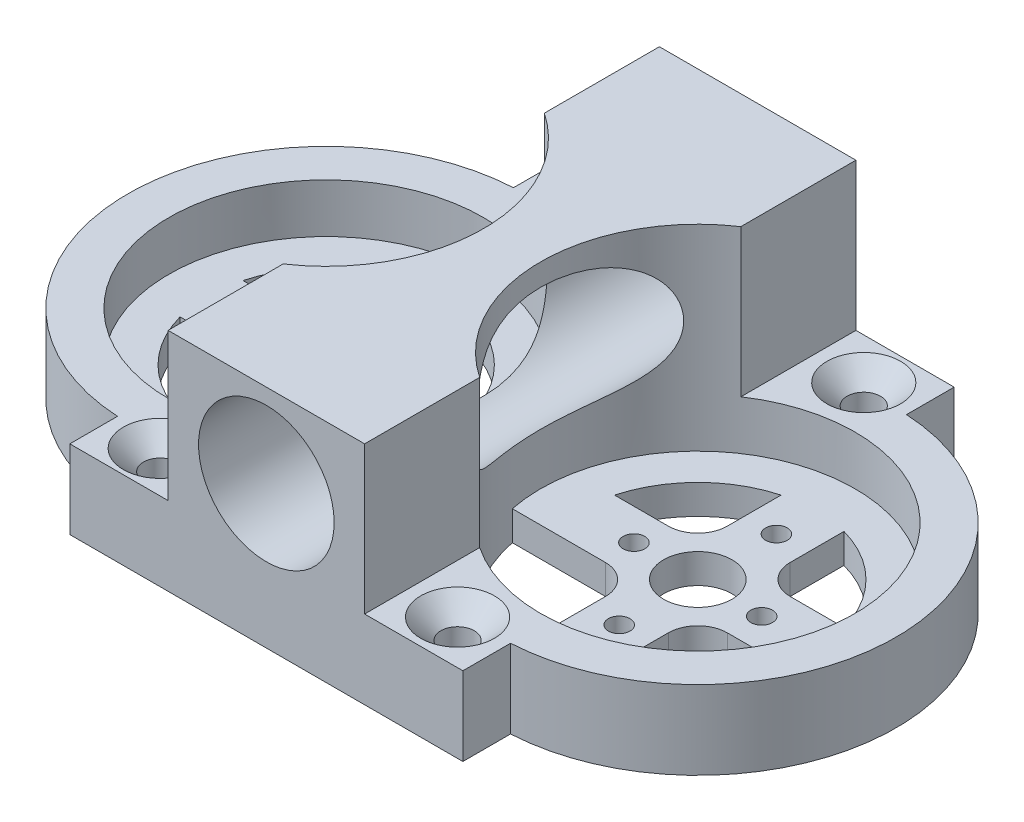
from build123d import *

# Parameters (mm, degrees)
BOSS_EXTRUDE1_DEPTH                                 = 8
SKETCH4_R                                           = 16
CUT_EXTRUDE1_DEPTH                                  = 5
CUT_EXTRUDE3_REACH                                  = 55.957
SKETCH6_R                                           = 1.1
SKETCH6_R_2                                         = 3.2
SKETCH6_R_3                                         = 3.481223099
BOSS_EXTRUDE2_START                                 = 15
BOSS_EXTRUDE2_DEPTH                                 = 15
CUT_EXTRUDE4_REACH                                  = 73.743
SKETCH7_R                                           = 6.9
CSK_FOR_M3_COUNTERSUNK_FLAT_HEAD_SCREW1_D           = 3.4
CSK_FOR_M3_COUNTERSUNK_FLAT_HEAD_SCREW1_DEPTH       = 10
CSK_FOR_M3_COUNTERSUNK_FLAT_HEAD_SCREW1_CSINK_D     = 7.5
CSK_FOR_M3_COUNTERSUNK_FLAT_HEAD_SCREW1_CSINK_ANGLE = 90
CSK_FOR_M3_COUNTERSUNK_FLAT_HEAD_SCREW1_TIP         = 1.021463052


with BuildPart() as part:
    # Sketch2 → Boss-Extrude1 (new body)
    with BuildSketch(Plane(origin=(0, 0, 0), x_dir=(1, 0, 0), z_dir=(0, 1, 0))):
        with BuildLine():
            Line((-26.93482114, -17.430691923), (-26.93482114, -22.282367874))
            Line((-26.93482114, -22.282367874), (13.06517886, -22.282367874))
            Line((13.06517886, -22.282367874), (13.06517886, -17.430691923))
            ThreePointArc((13.06517886, -17.430691923), (32.15296521, 2.717632126), (13.06517886, 22.865956175))
            Line((13.06517886, 22.865956175), (13.06517886, 27.717632126))
            Line((13.06517886, 27.717632126), (-26.93482114, 27.717632126))
            Line((-26.93482114, 27.717632126), (-26.93482114, 22.865956175))
            ThreePointArc((-26.93482114, 22.865956175), (-46.02260749, 2.717632126), (-26.93482114, -17.430691923))
        make_face()
    extrude(amount=BOSS_EXTRUDE1_DEPTH)

    # Sketch4 → Cut-Extrude1 (cut)
    with BuildSketch(Plane(origin=(0, 8, 0), x_dir=(1, 0, 0), z_dir=(0, 1, 0))):
        with Locations(Location((-25.84482114, 2.717632126, 0), (0, 0, 270))):
            Circle(SKETCH4_R)
        with Locations(Location((11.97517886, 2.717632126, 0), (0, 0, 270))):
            Circle(SKETCH4_R)
    extrude(amount=-CUT_EXTRUDE1_DEPTH, mode=Mode.SUBTRACT)

    # Sketch6 → Cut-Extrude3 (cut, up to next)
    with BuildSketch(Plane(origin=(0, 3, 0), x_dir=(1, 0, 0), z_dir=(0, 1, 0)), mode=Mode.PRIVATE) as cut_extrude3_sk1:
        with Locations(Location((-33.84482114, 2.717632126, 0), (0, 0, 270))):
            Circle(SKETCH6_R)
    cut_extrude3_tool1 = extrude(cut_extrude3_sk1.sketch, amount=-CUT_EXTRUDE3_REACH, mode=Mode.PRIVATE) & part.part
    # Sketch6 → Cut-Extrude3 (cut, up to next)
    with BuildSketch(Plane(origin=(0, 3, 0), x_dir=(1, 0, 0), z_dir=(0, 1, 0)), mode=Mode.PRIVATE) as cut_extrude3_sk2:
        with Locations(Location((-17.84482114, 2.717632126, 0), (0, 0, 270))):
            Circle(SKETCH6_R)
    cut_extrude3_tool2 = extrude(cut_extrude3_sk2.sketch, amount=-CUT_EXTRUDE3_REACH, mode=Mode.PRIVATE) & part.part
    # Sketch6 → Cut-Extrude3 (cut, up to next)
    with BuildSketch(Plane(origin=(0, 3, 0), x_dir=(1, 0, 0), z_dir=(0, 1, 0)), mode=Mode.PRIVATE) as cut_extrude3_sk3:
        with Locations(Location((-25.84482114, 8.717632126, 0), (0, 0, 270))):
            Circle(SKETCH6_R)
    cut_extrude3_tool3 = extrude(cut_extrude3_sk3.sketch, amount=-CUT_EXTRUDE3_REACH, mode=Mode.PRIVATE) & part.part
    # Sketch6 → Cut-Extrude3 (cut, up to next)
    with BuildSketch(Plane(origin=(0, 3, 0), x_dir=(1, 0, 0), z_dir=(0, 1, 0)), mode=Mode.PRIVATE) as cut_extrude3_sk4:
        with Locations(Location((-25.84482114, -3.282367874, 0), (0, 0, 270))):
            Circle(SKETCH6_R)
    cut_extrude3_tool4 = extrude(cut_extrude3_sk4.sketch, amount=-CUT_EXTRUDE3_REACH, mode=Mode.PRIVATE) & part.part
    # Sketch6 → Cut-Extrude3 (cut, up to next)
    with BuildSketch(Plane(origin=(0, 3, 0), x_dir=(1, 0, 0), z_dir=(0, 1, 0)), mode=Mode.PRIVATE) as cut_extrude3_sk5:
        with Locations(Location((-25.84482114, 2.717632126, 0), (0, 0, 270))):
            Circle(SKETCH6_R_2)
    cut_extrude3_tool5 = extrude(cut_extrude3_sk5.sketch, amount=-CUT_EXTRUDE3_REACH, mode=Mode.PRIVATE) & part.part
    # Sketch6 → Cut-Extrude3 (cut, up to next)
    with BuildSketch(Plane(origin=(0, 3, 0), x_dir=(1, 0, 0), z_dir=(0, 1, 0)), mode=Mode.PRIVATE) as cut_extrude3_sk6:
        with Locations(Location((18.47517886, 2.717632126, 0), (0, 0, 270))):
            Circle(SKETCH6_R)
    cut_extrude3_tool6 = extrude(cut_extrude3_sk6.sketch, amount=-CUT_EXTRUDE3_REACH, mode=Mode.PRIVATE) & part.part
    # Sketch6 → Cut-Extrude3 (cut, up to next)
    with BuildSketch(Plane(origin=(0, 3, 0), x_dir=(1, 0, 0), z_dir=(0, 1, 0)), mode=Mode.PRIVATE) as cut_extrude3_sk7:
        with Locations(Location((11.97517886, 10.717632126, 0), (0, 0, 270))):
            Circle(SKETCH6_R)
    cut_extrude3_tool7 = extrude(cut_extrude3_sk7.sketch, amount=-CUT_EXTRUDE3_REACH, mode=Mode.PRIVATE) & part.part
    # Sketch6 → Cut-Extrude3 (cut, up to next)
    with BuildSketch(Plane(origin=(0, 3, 0), x_dir=(1, 0, 0), z_dir=(0, 1, 0)), mode=Mode.PRIVATE) as cut_extrude3_sk8:
        with Locations(Location((5.47517886, 2.717632126, 0), (0, 0, 270))):
            Circle(SKETCH6_R)
    cut_extrude3_tool8 = extrude(cut_extrude3_sk8.sketch, amount=-CUT_EXTRUDE3_REACH, mode=Mode.PRIVATE) & part.part
    # Sketch6 → Cut-Extrude3 (cut, up to next)
    with BuildSketch(Plane(origin=(0, 3, 0), x_dir=(1, 0, 0), z_dir=(0, 1, 0)), mode=Mode.PRIVATE) as cut_extrude3_sk9:
        with Locations(Location((11.97517886, -5.282367874, 0), (0, 0, 270))):
            Circle(SKETCH6_R)
    cut_extrude3_tool9 = extrude(cut_extrude3_sk9.sketch, amount=-CUT_EXTRUDE3_REACH, mode=Mode.PRIVATE) & part.part
    # Sketch6 → Cut-Extrude3 (cut, up to next)
    with BuildSketch(Plane(origin=(0, 3, 0), x_dir=(1, 0, 0), z_dir=(0, 1, 0)), mode=Mode.PRIVATE) as cut_extrude3_sk10:
        with Locations(Location((11.97517886, 2.717632126, 0), (0, 0, 270))):
            Circle(SKETCH6_R_3)
    cut_extrude3_tool10 = extrude(cut_extrude3_sk10.sketch, amount=-CUT_EXTRUDE3_REACH, mode=Mode.PRIVATE) & part.part
    # Sketch6 → Cut-Extrude3 (cut, up to next)
    with BuildSketch(Plane(origin=(0, 3, 0), x_dir=(1, 0, 0), z_dir=(0, 1, 0)), mode=Mode.PRIVATE) as cut_extrude3_sk11:
        with BuildLine():
            Line((-29.04482114, -3.482367874), (-29.04482114, -8.95674259))
            ThreePointArc((-29.04482114, -8.95674259), (-34.404348726, -5.84189546), (-37.519195856, -0.482367874))
            Line((-37.519195856, -0.482367874), (-32.04482114, -0.482367874))
            ThreePointArc((-32.04482114, -0.482367874), (-29.923500797, -1.36104753), (-29.04482114, -3.482367874))
        make_face()
    cut_extrude3_tool11 = extrude(cut_extrude3_sk11.sketch, amount=-CUT_EXTRUDE3_REACH, mode=Mode.PRIVATE) & part.part
    # Sketch6 → Cut-Extrude3 (cut, up to next)
    with BuildSketch(Plane(origin=(0, 3, 0), x_dir=(1, 0, 0), z_dir=(0, 1, 0)), mode=Mode.PRIVATE) as cut_extrude3_sk12:
        with BuildLine():
            Line((-29.04482114, 8.917632126), (-29.04482114, 14.392006842))
            ThreePointArc((-29.04482114, 14.392006842), (-34.404348726, 11.277159712), (-37.519195856, 5.917632126))
            Line((-37.519195856, 5.917632126), (-32.04482114, 5.917632126))
            ThreePointArc((-32.04482114, 5.917632126), (-29.923500797, 6.796311782), (-29.04482114, 8.917632126))
        make_face()
    cut_extrude3_tool12 = extrude(cut_extrude3_sk12.sketch, amount=-CUT_EXTRUDE3_REACH, mode=Mode.PRIVATE) & part.part
    # Sketch6 → Cut-Extrude3 (cut, up to next)
    with BuildSketch(Plane(origin=(0, 3, 0), x_dir=(1, 0, 0), z_dir=(0, 1, 0)), mode=Mode.PRIVATE) as cut_extrude3_sk13:
        with BuildLine():
            Line((-22.64482114, 8.917632126), (-22.64482114, 14.392006842))
            ThreePointArc((-22.64482114, 14.392006842), (-17.285293554, 11.277159712), (-14.170446425, 5.917632126))
            Line((-14.170446425, 5.917632126), (-19.64482114, 5.917632126))
            ThreePointArc((-19.64482114, 5.917632126), (-21.766141484, 6.796311782), (-22.64482114, 8.917632126))
        make_face()
    cut_extrude3_tool13 = extrude(cut_extrude3_sk13.sketch, amount=-CUT_EXTRUDE3_REACH, mode=Mode.PRIVATE) & part.part
    # Sketch6 → Cut-Extrude3 (cut, up to next)
    with BuildSketch(Plane(origin=(0, 3, 0), x_dir=(1, 0, 0), z_dir=(0, 1, 0)), mode=Mode.PRIVATE) as cut_extrude3_sk14:
        with BuildLine():
            Line((-22.64482114, -3.482367874), (-22.64482114, -12.959102228))
            ThreePointArc((-22.64482114, -12.959102228), (-14.531112641, -8.596076373), (-10.168086786, -0.482367874))
            Line((-10.168086786, -0.482367874), (-19.64482114, -0.482367874))
            ThreePointArc((-19.64482114, -0.482367874), (-21.766141484, -1.36104753), (-22.64482114, -3.482367874))
        make_face()
    cut_extrude3_tool14 = extrude(cut_extrude3_sk14.sketch, amount=-CUT_EXTRUDE3_REACH, mode=Mode.PRIVATE) & part.part
    # Sketch6 → Cut-Extrude3 (cut, up to next)
    with BuildSketch(Plane(origin=(0, 3, 0), x_dir=(1, 0, 0), z_dir=(0, 1, 0)), mode=Mode.PRIVATE) as cut_extrude3_sk15:
        with BuildLine():
            Line((-3.701555494, -0.482367874), (5.77517886, -0.482367874))
            ThreePointArc((5.77517886, -0.482367874), (7.896499203, -1.36104753), (8.77517886, -3.482367874))
            Line((8.77517886, -3.482367874), (8.77517886, -12.959102228))
            ThreePointArc((8.77517886, -12.959102228), (0.661470361, -8.596076373), (-3.701555494, -0.482367874))
        make_face()
    cut_extrude3_tool15 = extrude(cut_extrude3_sk15.sketch, amount=-CUT_EXTRUDE3_REACH, mode=Mode.PRIVATE) & part.part
    # Sketch6 → Cut-Extrude3 (cut, up to next)
    with BuildSketch(Plane(origin=(0, 3, 0), x_dir=(1, 0, 0), z_dir=(0, 1, 0)), mode=Mode.PRIVATE) as cut_extrude3_sk16:
        with BuildLine():
            Line((0.300804144, 5.917632126), (5.77517886, 5.917632126))
            ThreePointArc((5.77517886, 5.917632126), (7.896499203, 6.796311782), (8.77517886, 8.917632126))
            Line((8.77517886, 8.917632126), (8.77517886, 14.392006842))
            ThreePointArc((8.77517886, 14.392006842), (3.415651274, 11.277159712), (0.300804144, 5.917632126))
        make_face()
    cut_extrude3_tool16 = extrude(cut_extrude3_sk16.sketch, amount=-CUT_EXTRUDE3_REACH, mode=Mode.PRIVATE) & part.part
    # Sketch6 → Cut-Extrude3 (cut, up to next)
    with BuildSketch(Plane(origin=(0, 3, 0), x_dir=(1, 0, 0), z_dir=(0, 1, 0)), mode=Mode.PRIVATE) as cut_extrude3_sk17:
        with BuildLine():
            Line((15.17517886, -8.95674259), (15.17517886, -3.482367874))
            ThreePointArc((15.17517886, -3.482367874), (16.053858516, -1.36104753), (18.17517886, -0.482367874))
            Line((18.17517886, -0.482367874), (23.649553575, -0.482367874))
            ThreePointArc((23.649553575, -0.482367874), (20.534706446, -5.84189546), (15.17517886, -8.95674259))
        make_face()
    cut_extrude3_tool17 = extrude(cut_extrude3_sk17.sketch, amount=-CUT_EXTRUDE3_REACH, mode=Mode.PRIVATE) & part.part
    # Sketch6 → Cut-Extrude3 (cut, up to next)
    with BuildSketch(Plane(origin=(0, 3, 0), x_dir=(1, 0, 0), z_dir=(0, 1, 0)), mode=Mode.PRIVATE) as cut_extrude3_sk18:
        with BuildLine():
            Line((18.17517886, 5.917632126), (23.649553575, 5.917632126))
            ThreePointArc((23.649553575, 5.917632126), (20.534706446, 11.277159712), (15.17517886, 14.392006842))
            Line((15.17517886, 14.392006842), (15.17517886, 8.917632126))
            ThreePointArc((15.17517886, 8.917632126), (16.053858516, 6.796311782), (18.17517886, 5.917632126))
        make_face()
    cut_extrude3_tool18 = extrude(cut_extrude3_sk18.sketch, amount=-CUT_EXTRUDE3_REACH, mode=Mode.PRIVATE) & part.part
    add(cut_extrude3_tool1.solids().sort_by_distance((-33.844821, 3, -2.717632))[0], mode=Mode.SUBTRACT)
    add(cut_extrude3_tool2.solids().sort_by_distance((-17.844821, 3, -2.717632))[0], mode=Mode.SUBTRACT)
    add(cut_extrude3_tool3.solids().sort_by_distance((-25.844821, 3, -8.717632))[0], mode=Mode.SUBTRACT)
    add(cut_extrude3_tool4.solids().sort_by_distance((-25.844821, 3, 3.282368))[0], mode=Mode.SUBTRACT)
    add(cut_extrude3_tool5.solids().sort_by_distance((-25.844821, 3, -2.717632))[0], mode=Mode.SUBTRACT)
    add(cut_extrude3_tool6.solids().sort_by_distance((18.475179, 3, -2.717632))[0], mode=Mode.SUBTRACT)
    add(cut_extrude3_tool7.solids().sort_by_distance((11.975179, 3, -10.717632))[0], mode=Mode.SUBTRACT)
    add(cut_extrude3_tool8.solids().sort_by_distance((5.475179, 3, -2.717632))[0], mode=Mode.SUBTRACT)
    add(cut_extrude3_tool9.solids().sort_by_distance((11.975179, 3, 5.282368))[0], mode=Mode.SUBTRACT)
    add(cut_extrude3_tool10.solids().sort_by_distance((11.975179, 3, -2.717632))[0], mode=Mode.SUBTRACT)
    add(cut_extrude3_tool11.solids().sort_by_distance((-32.4702, 3, 3.907747))[0], mode=Mode.SUBTRACT)
    add(cut_extrude3_tool12.solids().sort_by_distance((-32.4702, 3, -9.343011))[0], mode=Mode.SUBTRACT)
    add(cut_extrude3_tool13.solids().sort_by_distance((-19.219442, 3, -9.343011))[0], mode=Mode.SUBTRACT)
    add(cut_extrude3_tool14.solids().sort_by_distance((-17.587059, 3, 5.54013))[0], mode=Mode.SUBTRACT)
    add(cut_extrude3_tool15.solids().sort_by_distance((3.717417, 3, 5.54013))[0], mode=Mode.SUBTRACT)
    add(cut_extrude3_tool16.solids().sort_by_distance((5.3498, 3, -9.343011))[0], mode=Mode.SUBTRACT)
    add(cut_extrude3_tool17.solids().sort_by_distance((18.600558, 3, 3.907747))[0], mode=Mode.SUBTRACT)
    add(cut_extrude3_tool18.solids().sort_by_distance((18.600558, 3, -9.343011))[0], mode=Mode.SUBTRACT)

    # Sketch8 → Boss-Extrude2 (add)
    with BuildSketch(Plane(origin=(0, 8, 0), x_dir=(1, 0, 0), z_dir=(0, 1, 0)).offset(BOSS_EXTRUDE2_START)):
        with BuildLine():
            Line((-16.93482114, 27.717632126), (3.06517886, 27.717632126))
            Line((3.06517886, 27.717632126), (3.06517886, 16.007173126))
            ThreePointArc((3.06517886, 16.007173126), (-4.02482114, 2.717632126), (3.06517886, -10.571908874))
            Line((3.06517886, -10.571908874), (3.06517886, -22.282367874))
            Line((3.06517886, -22.282367874), (-16.93482114, -22.282367874))
            Line((-16.93482114, -22.282367874), (-16.93482114, -10.571908874))
            ThreePointArc((-16.93482114, -10.571908874), (-9.84482114, 2.717632126), (-16.93482114, 16.007173126))
            Line((-16.93482114, 16.007173126), (-16.93482114, 27.717632126))
        make_face()
    extrude(amount=-BOSS_EXTRUDE2_DEPTH)

    # Sketch7 → Cut-Extrude4 (cut, up to next)
    with BuildSketch(Plane.XY.offset(22.282367874), mode=Mode.PRIVATE) as cut_extrude4_sk1:
        with Locations((-6.93482114, 14.5)):
            Circle(SKETCH7_R)
    cut_extrude4_tool1 = extrude(cut_extrude4_sk1.sketch, amount=-CUT_EXTRUDE4_REACH, mode=Mode.PRIVATE) & part.part
    add(cut_extrude4_tool1.solids().sort_by_distance((-6.934821, 14.5, 22.282368))[0], mode=Mode.SUBTRACT)

    # CSK for M3 Countersunk Flat Head Screw1
    with Locations(Plane(origin=(0, 8, 0), x_dir=(1, 0, 0), z_dir=(0, 1, 0))):
        with Locations((8.06517886, 23.517632126), (-21.93482114, 23.517632126), (-21.93482114, -18.082367874), (8.06517886, -17.821765991)):
            CounterSinkHole(CSK_FOR_M3_COUNTERSUNK_FLAT_HEAD_SCREW1_D / 2, CSK_FOR_M3_COUNTERSUNK_FLAT_HEAD_SCREW1_CSINK_D / 2, depth=CSK_FOR_M3_COUNTERSUNK_FLAT_HEAD_SCREW1_DEPTH, counter_sink_angle=CSK_FOR_M3_COUNTERSUNK_FLAT_HEAD_SCREW1_CSINK_ANGLE)
            with Locations((0, 0, -(CSK_FOR_M3_COUNTERSUNK_FLAT_HEAD_SCREW1_DEPTH + CSK_FOR_M3_COUNTERSUNK_FLAT_HEAD_SCREW1_TIP / 2))):  # 118° drill point
                Cone(0, CSK_FOR_M3_COUNTERSUNK_FLAT_HEAD_SCREW1_D / 2, CSK_FOR_M3_COUNTERSUNK_FLAT_HEAD_SCREW1_TIP, mode=Mode.SUBTRACT)


solid = part.part
